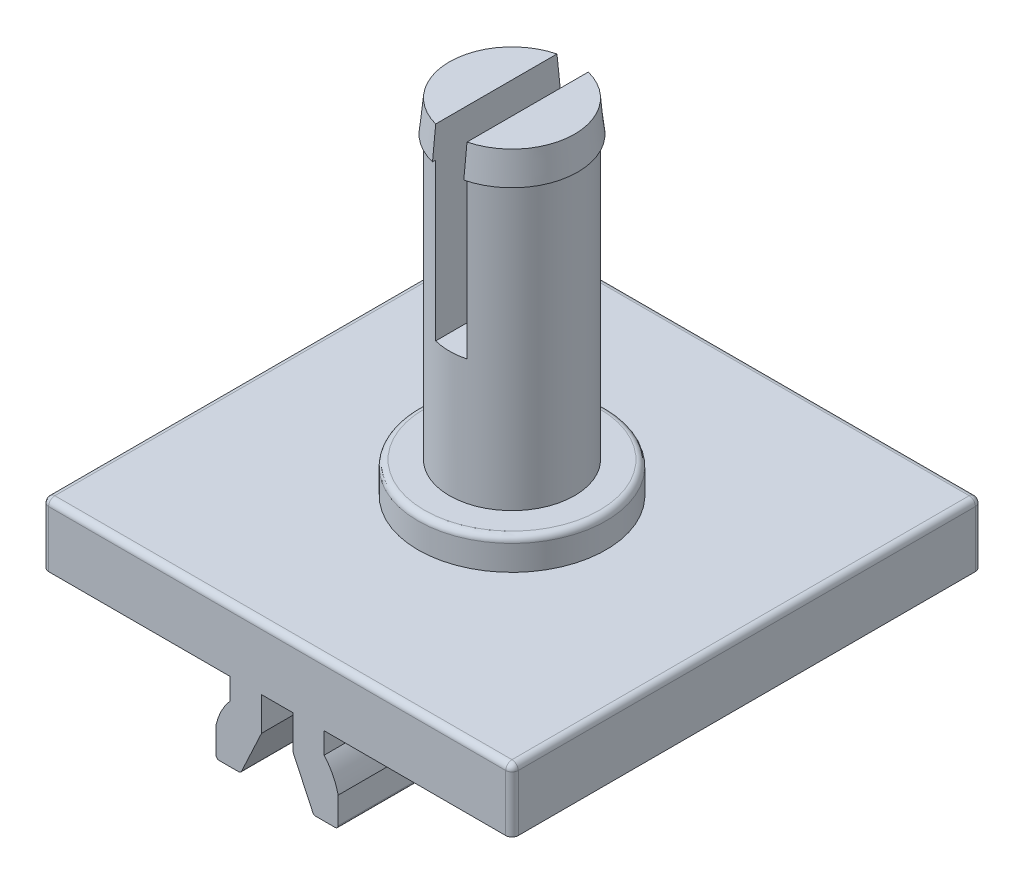
from build123d import *

# Parameters (mm, degrees)
SKETCH_1_W           = 15
SKETCH_1_H           = 15
EXTRUDE_1_DEPTH      = 2
SKETCH_2_R           = 3
EXTRUDE_2_DEPTH      = 1
SKETCH_3_R           = 2
EXTRUDE_3_DEPTH      = 10
SKETCH_5_W           = 1
SKETCH_5_H           = 6
CUT_EXTRUDE_1_DEPTH  = 6
EXTRUDE_4_DEPTH      = 7.5
EXTRUDE_4_DEPTH_BACK = 7.5
FILLET_1_R           = 0.2
FILLET_2_R           = 0.1


with BuildPart() as part:
    # 草图1 → 凸台-拉伸1 (new body)
    with BuildSketch(Plane(origin=(0, 0, 0), x_dir=(1, 0, 0), z_dir=(0, 1, 0))):
        Rectangle(SKETCH_1_W, SKETCH_1_H)
    extrude(amount=EXTRUDE_1_DEPTH)

    # 草图2 → 凸台-拉伸2 (add)
    with BuildSketch(Plane(origin=(0, 2, 0), x_dir=(1, 0, 0), z_dir=(0, 1, 0))):
        Circle(SKETCH_2_R)
    extrude(amount=EXTRUDE_2_DEPTH)

    # 草图3 → 凸台-拉伸3 (add)
    with BuildSketch(Plane(origin=(0, 3, 0), x_dir=(1, 0, 0), z_dir=(0, 1, 0))):
        Circle(SKETCH_3_R)
    extrude(amount=EXTRUDE_3_DEPTH)

    # 草图4 → 旋转1 (revolve)
    with BuildSketch(Plane.XY):
        Polygon((0, 13), (-2, 13), (-2.1, 12), (0, 12), align=None)
    revolve(axis=Axis((0, 12, 0), (0, 1, 0)))

    # 草图5 → 切除-拉伸1 (cut)
    with BuildSketch(Plane(origin=(0, 13, 0), x_dir=(1, 0, 0), z_dir=(0, 1, 0))):
        Rectangle(SKETCH_5_W, SKETCH_5_H)
    extrude(amount=-CUT_EXTRUDE_1_DEPTH, mode=Mode.SUBTRACT)

    # 草图6 → 凸台-拉伸4 (add, two sides: drawn at the far end of the back side and taken through both)
    with BuildSketch(Plane.XY.offset(-EXTRUDE_4_DEPTH_BACK)):
        with BuildLine():
            Line((-0.5, 0), (-1.5, 0))
            Line((-1.5, 0), (-1.5, -0.677124344))
            ThreePointArc((-1.5, -0.677124344), (-1.780042303, -1.088161527), (-1.95, -1.555590279))
            Line((-1.95, -1.555590279), (-1.95, -2.5))
            Line((-1.95, -2.5), (-1.165769145, -2.5))
            Line((-1.165769145, -2.5), (-0.5, -1.07225346))
            Line((-0.5, -1.07225346), (-0.5, 0))
        make_face()
        with BuildLine():
            Line((0.5, 0), (0.5, -1.07225346))
            Line((0.5, -1.07225346), (1.165769145, -2.5))
            Line((1.165769145, -2.5), (1.95, -2.5))
            Line((1.95, -2.5), (1.95, -1.555590279))
            ThreePointArc((1.95, -1.555590279), (1.780042303, -1.088161527), (1.5, -0.677124344))
            Line((1.5, -0.677124344), (1.5, 0))
            Line((1.5, 0), (0.5, 0))
        make_face()
    extrude(amount=EXTRUDE_4_DEPTH + EXTRUDE_4_DEPTH_BACK)

    # 圆角1
    fillet_1_edges = [part.edges().sort_by_distance(p)[0] for p in [
        (-7.5, 1, -7.5),
        (7.5, 1, -7.5),
        (7.5, 1, 7.5),
        (-7.5, 1, 7.5),
        (7.5, 2, 0),
        (0, 2, -7.5),
        (-7.5, 2, 0),
        (0, 2, 7.5),
        (-3, 3, 0),
    ]]
    fillet(fillet_1_edges, radius=FILLET_1_R)

    # 圆角2
    fillet_2_edges = [part.edges().sort_by_distance(p)[0] for p in [
        (-1.95, -2.5, 0),
        (-1.165769145, -2.5, 0),
        (1.165769145, -2.5, 0),
        (1.95, -2.5, 0),
    ]]
    fillet(fillet_2_edges, radius=FILLET_2_R)


solid = part.part
